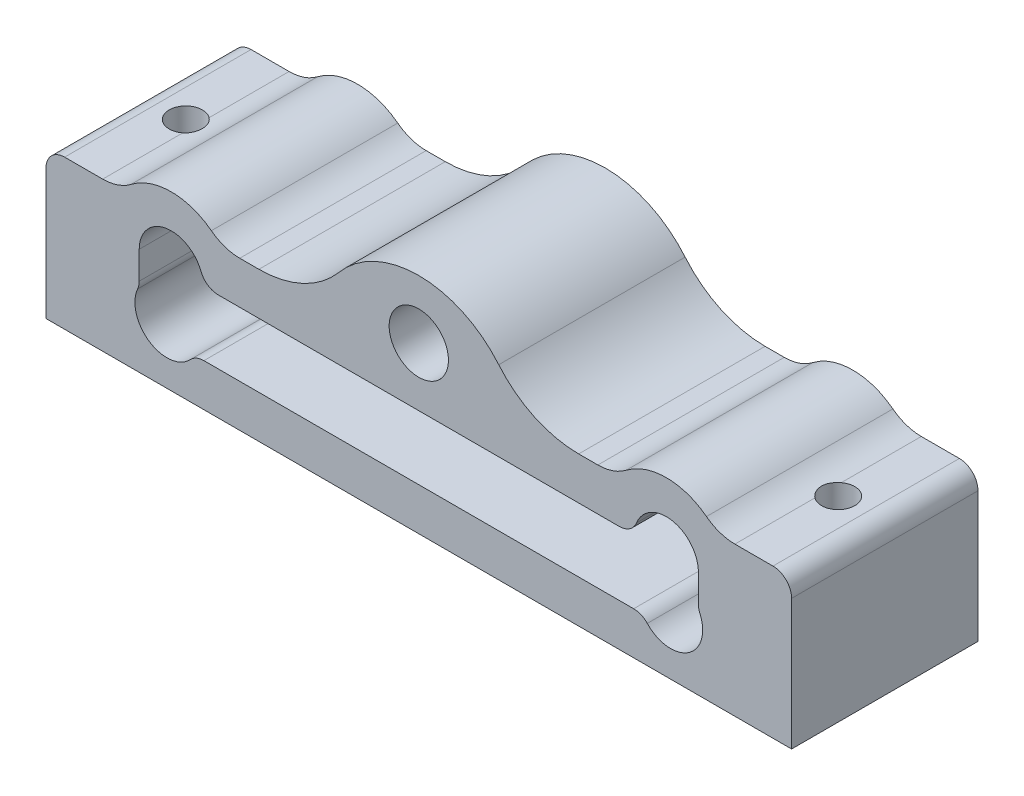
from build123d import *

# Parameters (mm, degrees)
SKETCH1_W                  = 38.1
SKETCH1_H                  = 4.365625
BOSS_EXTRUDE1_DEPTH        = 12.7
BOSS_EXTRUDE3_DEPTH        = 12.7
SKETCH8_R                  = 2.1828125
CUT_EXTRUDE1_DEPTH         = 30.170285502
SKETCH11_R                 = 2.1828125
CUT_EXTRUDE2_DEPTH         = 30.170285502
FILLET1_R                  = 3.175
FILLET2_R                  = 3.175
F_4_40_TAPPED_HOLE1_D      = 2.2606
BOSS_EXTRUDE4_DEPTH        = 12.7
TAP_DRILL_FOR_10_32_TAP1_D = 4.0386
FILLET3_R                  = 1.27
FILLET4_R                  = 1.27
CHAMFER1_SIZE              = 0.254


with BuildPart() as part:
    # Sketch1 → Boss-Extrude1 (new body)
    with BuildSketch(Plane.XY):
        Polygon((6.35, 5.08), (25.4, 5.08), (25.4, -5.08), (-25.4, -5.08), (-25.4, 5.08), (-6.35, 5.08), align=None)
        Rectangle(SKETCH1_W, SKETCH1_H, mode=Mode.SUBTRACT)
    extrude(amount=BOSS_EXTRUDE1_DEPTH)

    # Sketch7 → Boss-Extrude3 (add)
    with BuildSketch(Plane.XY.offset(12.7)):
        with BuildLine():
            Line((-20.290450061, 5.08), (-13.443924939, 5.08))
            ThreePointArc((-13.443924939, 5.08), (-16.8671875, 6.6675), (-20.290450061, 5.08))
        make_face()
    boss_extrude3 = extrude(amount=-BOSS_EXTRUDE3_DEPTH)

    # Sketch8 → Cut-Extrude1 (cut, through all)
    with BuildSketch(Plane.XY.offset(12.7)):
        with Locations((-16.8671875, 2.1828125)):
            Circle(SKETCH8_R)
    cut_extrude1 = extrude(amount=-CUT_EXTRUDE1_DEPTH, mode=Mode.SUBTRACT)

    # Sketch11 → Cut-Extrude2 (cut, through all)
    with BuildSketch(Plane.XY.offset(12.7)):
        with Locations((-17.159628923, -1.09140625)):
            Circle(SKETCH11_R)
    cut_extrude2 = extrude(amount=-CUT_EXTRUDE2_DEPTH, mode=Mode.SUBTRACT)

    # Fillet1
    fillet1_edges = [part.edges().sort_by_distance(p)[0] for p in [
        (-13.443924939, 5.08, 6.35),
        (-20.290450061, 5.08, 6.35),
    ]]
    fillet(fillet1_edges, radius=FILLET1_R)

    # Mirror1: Cut-Extrude1, Cut-Extrude2 across plane
    add(cut_extrude1.mirror(Plane(origin=(0, 0, 0), x_dir=(0, 0, 1), z_dir=(1, 0, 0))), mode=Mode.SUBTRACT)
    add(cut_extrude2.mirror(Plane(origin=(0, 0, 0), x_dir=(0, 0, 1), z_dir=(1, 0, 0))), mode=Mode.SUBTRACT)

    # Mirror2: Boss-Extrude3 across plane
    add(boss_extrude3.mirror(Plane(origin=(0, 0, 0), x_dir=(0, 0, 1), z_dir=(1, 0, 0))))

    # Fillet2
    fillet2_edges = [part.edges().sort_by_distance(p)[0] for p in [
        (13.443924939, 5.08, 6.35),
        (20.290450061, 5.08, 6.35),
    ]]
    fillet(fillet2_edges, radius=FILLET2_R)

    # #4-40 Tapped Hole1 (through all)
    with Locations(Plane(origin=(0, -5.08, 0), x_dir=(-1, 0, 0), z_dir=(0, -1, 0))):
        with Locations((22.225, -6.35), (-22.225, -6.35)):
            Hole(F_4_40_TAPPED_HOLE1_D / 2)

    # Sketch10 → Boss-Extrude4 (add)
    with BuildSketch(Plane.XY.offset(12.7)):
        with BuildLine():
            Line((-10.894095156, 5.08), (10.894095156, 5.08))
            ThreePointArc((10.894095156, 5.08), (7.889019146, 5.746209312), (5.447047578, 7.62))
            ThreePointArc((5.447047578, 7.62), (0, 10.16), (-5.447047578, 7.62))
            ThreePointArc((-5.447047578, 7.62), (-7.889019146, 5.746209312), (-10.894095156, 5.08))
        make_face()
    extrude(amount=-BOSS_EXTRUDE4_DEPTH)

    # Tap Drill for #10-32 Tap1 (through all)
    with Locations(Plane.XY.offset(12.7)):
        with Locations((0, 6.17140625)):
            Hole(TAP_DRILL_FOR_10_32_TAP1_D / 2)

    # Fillet3
    fillet3_edges = [part.edges().sort_by_distance(p)[0] for p in [
        (-14.684375, 2.1828125, 6.35),
        (-15.269257847, -2.1828125, 6.35),
        (-19.05, 0, 6.35),
        (14.684375, 2.1828125, 6.35),
        (19.05, 0, 6.35),
        (15.269257847, -2.1828125, 6.35),
    ]]
    fillet(fillet3_edges, radius=FILLET3_R)

    # Fillet4
    fillet4_edges = [part.edges().sort_by_distance(p)[0] for p in [
        (-25.4, 5.08, 6.35),
        (25.4, 5.08, 6.35),
    ]]
    fillet(fillet4_edges, radius=FILLET4_R)

    # Chamfer1
    chamfer1_edges = [part.edges().sort_by_distance(p)[0] for p in [
        (-18.362829894, -2.912663462, 0),
        (0, -2.1828125, 0),
        (18.362829894, -2.912663462, 0),
        (19.05, 1.241039162, 0),
        (17.275850124, 4.327029203, 0),
        (0, 2.1828125, 0),
        (-17.275850124, 4.327029203, 0),
        (-14.370442252, 2.402538589, 0),
        (14.370442252, 2.402538589, 0),
        (-15.14545512, -2.287485231, 0),
        (15.14545512, -2.287485231, 0),
        (19.077182057, 0.037916326, 0),
        (-19.077182057, 0.037916326, 0),
        (-19.05, 1.241039162, 0),
    ]]
    chamfer(chamfer1_edges, length=CHAMFER1_SIZE)


solid = part.part
